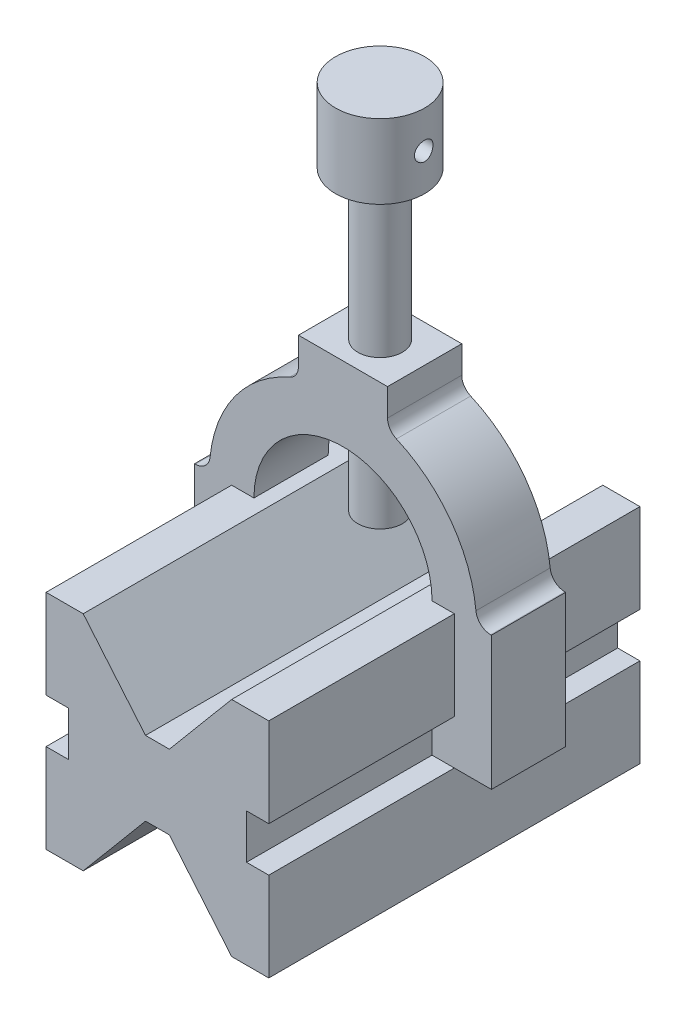
from build123d import *

# Parameters (mm, degrees)
BOSS_EXTRUDE1_DEPTH      = 60
BOSS_EXTRUDE1_DEPTH_BACK = 40
SKETCH2_W                = 60
SKETCH2_H                = 60
CUT_EXTRUDE1_DEPTH       = 109.627804912
CUT_EXTRUDE1_DEPTH_BACK  = 109.627804912
SKETCH3_W                = 16
SKETCH3_H                = 12
CUT_EXTRUDE2_DEPTH       = 74.484692283
CUT_EXTRUDE2_DEPTH_BACK  = 74.484692283
SKETCH5_W                = 16
SKETCH5_H                = 12
BOSS_EXTRUDE2_DEPTH      = 10
BOSS_EXTRUDE2_2_DEPTH    = 10
SKETCH7_W                = 10
SKETCH7_H                = 24
BOSS_EXTRUDE3_DEPTH      = 10
BOSS_EXTRUDE3_2_DEPTH    = 10
BOSS_EXTRUDE4_DEPTH      = 10
SKETCH10_W               = 24
SKETCH10_H               = 16
BOSS_EXTRUDE5_DEPTH      = 10
FILLET1_R                = 4
BOSS_EXTRUDE6_DEPTH      = 40
BOSS_EXTRUDE6_DEPTH_BACK = 40
BOSS_EXTRUDE6_START      = 74
SKETCH11_R               = 6
BOSS_EXTRUDE7_START      = 114
SKETCH12_R               = 12
BOSS_EXTRUDE7_DEPTH      = 20
CUT_EXTRUDE4_DEPTH       = 153.170956493
CUT_EXTRUDE4_DEPTH_BACK  = 153.170956493
SKETCH13_R               = 2.5


with BuildPart() as part:
    # Sketch2 → Boss-Extrude1 (new, two sides: drawn at the far end of the back side and taken through both)
    with BuildSketch(Plane.XY.offset(-BOSS_EXTRUDE1_DEPTH_BACK)):
        Rectangle(SKETCH2_W, SKETCH2_H)
    extrude(amount=BOSS_EXTRUDE1_DEPTH + BOSS_EXTRUDE1_DEPTH_BACK)

    # Sketch3 → Cut-Extrude1 (cut, two sides: drawn at the far end of the back side and taken through both)
    with BuildSketch(Plane.XY.offset(60).offset(-CUT_EXTRUDE1_DEPTH_BACK)):
        with Locations((32, 0)):
            Rectangle(SKETCH3_W, SKETCH3_H)
        with Locations((-32, 0)):
            Rectangle(SKETCH3_W, SKETCH3_H)
    extrude(amount=CUT_EXTRUDE1_DEPTH + CUT_EXTRUDE1_DEPTH_BACK, mode=Mode.SUBTRACT)

    # Sketch4 → Cut-Extrude2 (cut, two sides: drawn at the far end of the back side and taken through both)
    with BuildSketch(Plane.XY.offset(-CUT_EXTRUDE2_DEPTH_BACK)):
        Polygon((-20, -30), (-3.218007376, -10), (3.218007376, -10), (20, -30), (20, -54.733216857), (-20, -54.733216857), align=None)
        Polygon((-20, 30), (-3.218007376, 10), (3.218007376, 10), (20, 30), (20, 60.547100054), (-20, 60.547100054), align=None)
    extrude(amount=CUT_EXTRUDE2_DEPTH + CUT_EXTRUDE2_DEPTH_BACK, mode=Mode.SUBTRACT)


with BuildPart() as body_2:
    # Sketch5 → Boss-Extrude2 (new, symmetric)
    with BuildSketch(Plane.XY):
        with Locations((32, 0)):
            Rectangle(SKETCH5_W, SKETCH5_H)
    extrude(amount=BOSS_EXTRUDE2_DEPTH, both=True)


with BuildPart() as body_3:
    # Sketch5 → Boss-Extrude2 2 (new, symmetric)
    with BuildSketch(Plane.XY):
        with Locations((-32, 0)):
            Rectangle(SKETCH5_W, SKETCH5_H)
    extrude(amount=BOSS_EXTRUDE2_2_DEPTH, both=True)


with BuildPart() as body_4:
    # Sketch7 → Boss-Extrude3 (new, symmetric)
    with BuildSketch(Plane.XY):
        with Locations((-35, 18)):
            Rectangle(SKETCH7_W, SKETCH7_H)
    extrude(amount=BOSS_EXTRUDE3_DEPTH, both=True)


with BuildPart() as body_5:
    # Sketch7 → Boss-Extrude3 2 (new, symmetric)
    with BuildSketch(Plane.XY):
        with Locations((35, 18)):
            Rectangle(SKETCH7_W, SKETCH7_H)
    extrude(amount=BOSS_EXTRUDE3_2_DEPTH, both=True)


with BuildPart() as body_6:
    # Sketch8 → Boss-Extrude4 (new, symmetric)
    with BuildSketch(Plane.XY):
        with BuildLine():
            Line((24, 30), (36, 30))
            ThreePointArc((36, 30), (0, 66), (-36, 30))
            Line((-36, 30), (-24, 30))
            ThreePointArc((-24, 30), (0, 54), (24, 30))
        make_face()
    extrude(amount=BOSS_EXTRUDE4_DEPTH, both=True)

    # Combine1: union body 5, body 4, body 3, body 2
    add(body_5.part)
    add(body_4.part)
    add(body_3.part)
    add(body_2.part)

    # Sketch10 → Boss-Extrude5 (add, symmetric)
    with BuildSketch(Plane.XY):
        with Locations((0, 66)):
            Rectangle(SKETCH10_W, SKETCH10_H)
    extrude(amount=BOSS_EXTRUDE5_DEPTH, both=True)

    # Fillet1
    fillet1_edges = [body_6.edges().sort_by_distance(p)[0] for p in [
        (12, 63.941125497, 0),
        (-12, 63.941125497, 0),
        (-36, 30, 0),
        (36, 30, 0),
    ]]
    fillet(fillet1_edges, radius=FILLET1_R)


with BuildPart() as body_3_2:
    # Sketch11 → Boss-Extrude6 (new, two sides: drawn at the far end of the back side and taken through both)
    with BuildSketch(Plane(origin=(0, 0, 0), x_dir=(1, 0, 0), z_dir=(0, 1, 0)).offset(BOSS_EXTRUDE6_START - BOSS_EXTRUDE6_DEPTH_BACK)):
        with Locations(Location((0, 0, 0), (0, 0, 90))):
            Circle(SKETCH11_R)
    extrude(amount=BOSS_EXTRUDE6_DEPTH + BOSS_EXTRUDE6_DEPTH_BACK)


with BuildPart() as body_4_2:
    # Sketch12 → Boss-Extrude7 (new body)
    with BuildSketch(Plane(origin=(0, 0, 0), x_dir=(1, 0, 0), z_dir=(0, 1, 0)).offset(BOSS_EXTRUDE7_START)):
        with Locations(Location((0, 0, 0), (0, 0, 90))):
            Circle(SKETCH12_R)
    extrude(amount=BOSS_EXTRUDE7_DEPTH)

    # Combine2: union body 3 2
    add(body_3_2.part)

    # Sketch13 → Cut-Extrude4 (cut, two sides: drawn at the far end of the back side and taken through both)
    with BuildSketch(Plane(origin=(0, 0, 0), x_dir=(0, 0, -1), z_dir=(1, 0, 0)).offset(-CUT_EXTRUDE4_DEPTH_BACK)):
        with Locations((0, 124)):
            Circle(SKETCH13_R)
    extrude(amount=CUT_EXTRUDE4_DEPTH + CUT_EXTRUDE4_DEPTH_BACK, mode=Mode.SUBTRACT)


solid = Compound([part.part, body_6.part, body_4_2.part])
